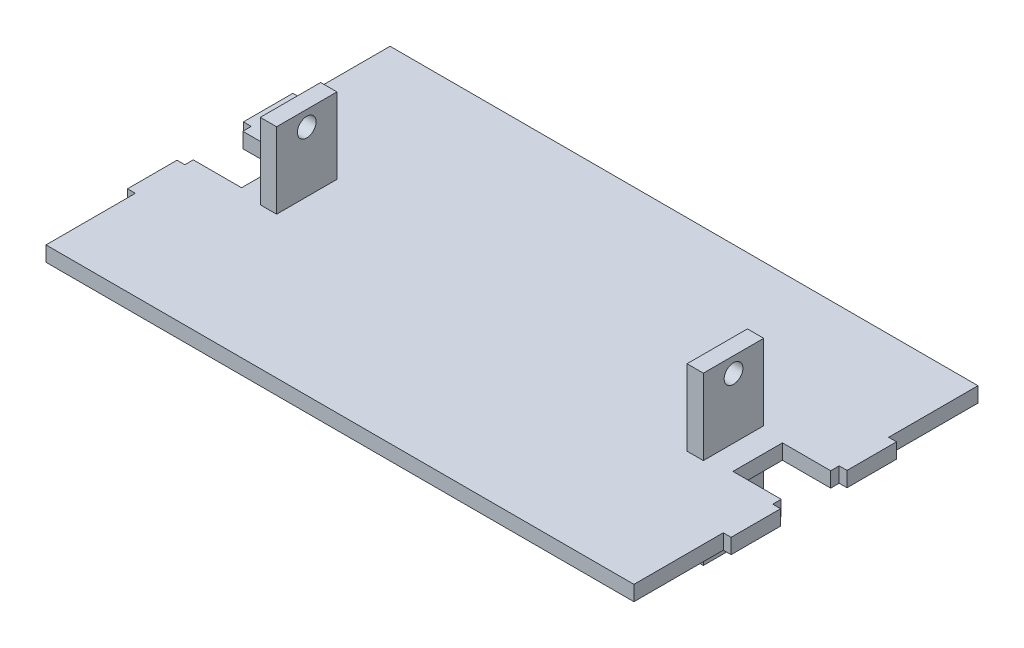
from build123d import *

# Parameters (mm, degrees)
BOSS_EXTRUDE1_DEPTH     = 3.175
SKETCH2_W               = 6.858
SKETCH2_H               = 25.4
BOSS_EXTRUDE2_DEPTH     = 35.052
CUT_EXTRUDE1_DEPTH      = 235.445990215
CUT_EXTRUDE1_DEPTH_BACK = 235.445990215
SKETCH3_R               = 3.937


with BuildPart() as part:
    # Sketch1 → Boss-Extrude1 (new, symmetric)
    with BuildSketch(Plane(origin=(0, 0, 0), x_dir=(1, 0, 0), z_dir=(0, 1, 0))):
        Polygon((123.698, -72.39), (-123.698, -72.39), (-123.698, -34.798), (-127, -34.798), (-127, -13.97), (-123.698, -13.97), (-123.698, -10.414), (-103.378, -10.414), (-103.378, 10.414), (-123.698, 10.414), (-123.698, 13.97), (-127, 13.97), (-127, 34.798), (-123.698, 34.798), (-123.698, 72.39), (123.698, 72.39), (123.698, 34.798), (127, 34.798), (127, 13.97), (123.698, 13.97), (123.698, 10.414), (103.378, 10.414), (103.378, -10.414), (123.698, -10.414), (123.698, -13.97), (127, -13.97), (127, -34.798), (123.698, -34.798), align=None)
    extrude(amount=BOSS_EXTRUDE1_DEPTH, both=True)

    # Sketch2 → Boss-Extrude2 (add, symmetric)
    with BuildSketch(Plane(origin=(0, 0, 0), x_dir=(1, 0, 0), z_dir=(0, 1, 0))):
        with Locations((89.789, 0)):
            Rectangle(SKETCH2_W, SKETCH2_H)
        with Locations((-89.789, 0)):
            Rectangle(SKETCH2_W, SKETCH2_H)
    extrude(amount=BOSS_EXTRUDE2_DEPTH, both=True)

    # Sketch3 → Cut-Extrude1 (cut, two sides: drawn at the far end of the back side and taken through both)
    with BuildSketch(Plane.ZY.offset(93.218).offset(-CUT_EXTRUDE1_DEPTH_BACK)):
        with Locations((0, 28.575)):
            Circle(SKETCH3_R)
        with Locations((0, -28.575)):
            Circle(SKETCH3_R)
    extrude(amount=CUT_EXTRUDE1_DEPTH + CUT_EXTRUDE1_DEPTH_BACK, mode=Mode.SUBTRACT)


solid = part.part
